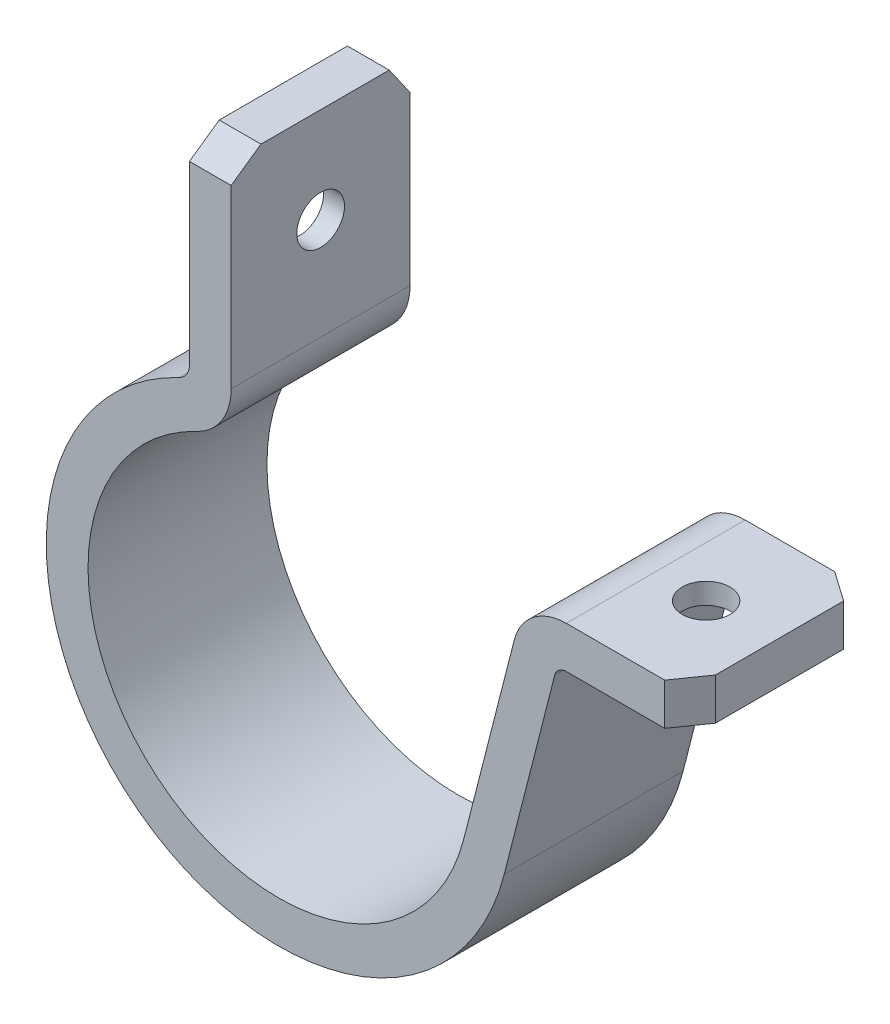
from build123d import *
from OCP.BRepFilletAPI import BRepFilletAPI_MakeChamfer

# Parameters (mm, degrees)
BOSS_EXTRUDE1_DEPTH = 15
SKETCH2_R           = 2
CUT_EXTRUDE1_DEPTH  = 52.967393623
SKETCH3_R           = 2
CUT_EXTRUDE2_DEPTH  = 3.5
CHAMFER1_SIZE       = 2.5
CHAMFER1_SIZE2      = 1.750518846
CHAMFER2_SIZE       = 2.5
CHAMFER2_SIZE2      = 1.750518846
FILLET1_R           = 5
FILLET2_R           = 1.5
FILLET3_R           = 1
FILLET4_R           = 4.5


with BuildPart() as part:
    # Sketch1 → Boss-Extrude1 (new body)
    with BuildSketch(Plane.XY):
        with BuildLine():
            Line((24.6, 0), (38.1, 0))
            Line((38.1, 0), (38.1, -3.5))
            Line((38.1, -3.5), (27.318446602, -3.5))
            Line((27.318446602, -3.5), (22.893526956, -20.825415956))
            ThreePointArc((22.893526956, -20.825415956), (-8.755509301, -30.749473973), (-3.5, 2))
            Line((-3.5, 2), (-3.5, 19.491933385))
            Line((-3.5, 19.491933385), (0, 19.491933385))
            Line((0, 19.491933385), (0, -0.508066615))
            ThreePointArc((0, -0.508066615), (-7.298847951, -27.328549553), (19.502381092, -19.959315656))
            Line((19.502381092, -19.959315656), (24.6, 0))
        make_face()
    extrude(amount=BOSS_EXTRUDE1_DEPTH)

    # Sketch2 → Cut-Extrude1 (cut, through all)
    with BuildSketch(Plane.XZ.offset(3.5)):
        with Locations(Location((32.318446602, 7.5, 0), (0, 0, 270))):
            Circle(SKETCH2_R)
    extrude(amount=-CUT_EXTRUDE1_DEPTH, mode=Mode.SUBTRACT)

    # Sketch3 → Cut-Extrude2 (cut)
    with BuildSketch(Plane.ZY.offset(3.5)):
        with Locations(Location((7.5, 11.491933385, 0), (0, 0, 270))):
            Circle(SKETCH3_R)
    extrude(amount=-CUT_EXTRUDE2_DEPTH, mode=Mode.SUBTRACT)

    # Chamfer1: one chamfer whose edges measure the first distance from different faces: ONE call of the kernel's chamfer builder (chamfer() names one face for all edges)
    chamfer1_edges_1 = [part.edges().sort_by_distance(p)[0] for p in [
        (32.318446602, -3.5, 9.5),
    ]]
    chamfer1_side_1 = [part.faces().sort_by_distance(p)[0] for p in [
        (37.915272662, -3.5, 7.5),
    ]]
    chamfer1_edges_2 = [part.edges().sort_by_distance(p)[0] for p in [
        (-3.5, 13.491933385, 7.5),
    ]]
    chamfer1_side_2 = [part.faces().sort_by_distance(p)[0] for p in [
        (-3.5, 2.230427371, 7.5),
    ]]
    chamfer1 = BRepFilletAPI_MakeChamfer(part.part.solid().wrapped)
    for e in chamfer1_edges_1:
        chamfer1.Add(CHAMFER1_SIZE, CHAMFER1_SIZE2, e.wrapped, chamfer1_side_1[0].wrapped)  # the first distance lies on this face
    for e in chamfer1_edges_2:
        chamfer1.Add(CHAMFER1_SIZE, CHAMFER1_SIZE2, e.wrapped, chamfer1_side_2[0].wrapped)  # the first distance lies on this face
    add(Compound.cast(chamfer1.Shape()), mode=Mode.REPLACE)

    # Chamfer2: one chamfer whose edges measure the first distance from different faces: ONE call of the kernel's chamfer builder (chamfer() names one face for all edges)
    chamfer2_edges_1 = [part.edges().sort_by_distance(p)[0] for p in [
        (-1.75, 19.491933385, 0),
        (38.1, -1.75, 0),
    ]]
    chamfer2_side_1 = [part.faces().sort_by_distance(p)[0] for p in [
        (-2.732075997, 10.745966692, 0),
    ]]
    chamfer2_edges_2 = [part.edges().sort_by_distance(p)[0] for p in [
        (-1.75, 19.491933385, 15),
    ]]
    chamfer2_side_2 = [part.faces().sort_by_distance(p)[0] for p in [
        (-1.75, 19.491933385, 7.5),
    ]]
    chamfer2_edges_3 = [part.edges().sort_by_distance(p)[0] for p in [
        (38.1, -1.75, 15),
    ]]
    chamfer2_side_3 = [part.faces().sort_by_distance(p)[0] for p in [
        (38.1, -1.75, 7.5),
    ]]
    chamfer2 = BRepFilletAPI_MakeChamfer(part.part.solid().wrapped)
    for e in chamfer2_edges_1:
        chamfer2.Add(CHAMFER2_SIZE, CHAMFER2_SIZE2, e.wrapped, chamfer2_side_1[0].wrapped)  # the first distance lies on this face
    for e in chamfer2_edges_2:
        chamfer2.Add(CHAMFER2_SIZE, CHAMFER2_SIZE2, e.wrapped, chamfer2_side_2[0].wrapped)  # the first distance lies on this face
    for e in chamfer2_edges_3:
        chamfer2.Add(CHAMFER2_SIZE, CHAMFER2_SIZE2, e.wrapped, chamfer2_side_3[0].wrapped)  # the first distance lies on this face
    add(Compound.cast(chamfer2.Shape()), mode=Mode.REPLACE)

    # Fillet1
    fillet1_edges = [part.edges().sort_by_distance(p)[0] for p in [
        (0, -0.508066615, 7.5),
    ]]
    fillet(fillet1_edges, radius=FILLET1_R)

    # Fillet2
    fillet2_edges = [part.edges().sort_by_distance(p)[0] for p in [
        (-3.5, 2, 7.5),
    ]]
    fillet(fillet2_edges, radius=FILLET2_R)

    # Fillet3
    fillet3_edges = [part.edges().sort_by_distance(p)[0] for p in [
        (27.318446602, -3.5, 7.5),
    ]]
    fillet(fillet3_edges, radius=FILLET3_R)

    # Fillet4
    fillet4_edges = [part.edges().sort_by_distance(p)[0] for p in [
        (24.6, 0, 7.5),
    ]]
    fillet(fillet4_edges, radius=FILLET4_R)


solid = part.part
